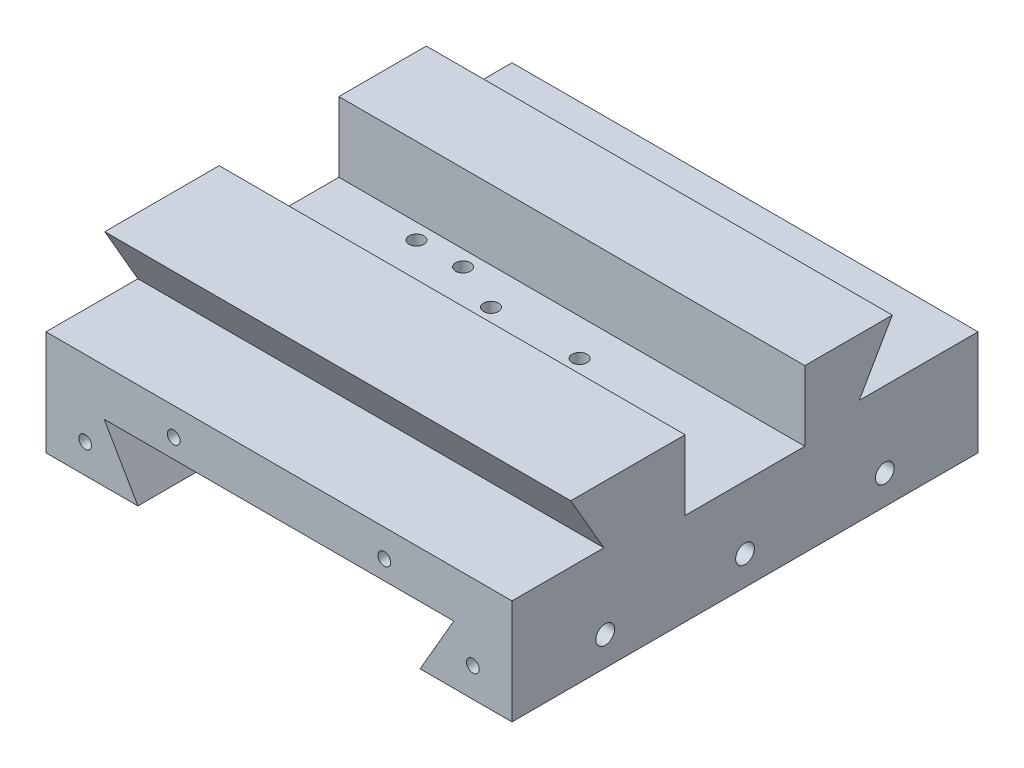
from build123d import *

# Parameters (mm, degrees)
X_CARRIAGE_EXTRUDE_DEPTH                 = 63.5
Y_GUIDE_CUT_EXTRUDE_DEPTH                = 63.5
F_8_32_TAPPED_HOLE1_D                    = 3.4544
F_8_32_TAPPED_HOLE1_DEPTH                = 12.3444
F_8_32_TAPPED_HOLE1_TIP                  = 1.037806461
F_8_32_TAPPED_HOLE2_D                    = 3.4544
F_8_32_TAPPED_HOLE2_DEPTH                = 12.446
F_8_32_TAPPED_HOLE2_TIP                  = 1.037806461
SKETCH8_W                                = 2.5527
SKETCH8_H                                = 63.5
GIB_SCREW_1_4_20_TAPPED_HOLE1_AT_2_COUNT = 2
GIB_SCREW_1_4_20_TAPPED_HOLE1_AT_2_PITCH = 38.1
GIB_SCREW_1_4_20_TAPPED_HOLE1_AT_3_COUNT = 2
GIB_SCREW_1_4_20_TAPPED_HOLE1_AT_3_PITCH = 76.2
F_10_32_TAPPED_HOLE1_D                   = 4.0386
F_10_32_TAPPED_HOLE1_DEPTH               = 9.271


with BuildPart() as part:
    # female-dovetail-profile → x-carriage-extrude (new, symmetric)
    with BuildSketch(Plane.XY):
        Polygon((-47.625, 15.875), (-40.292651581, 15.875), (-16.056336319, 15.875), (16.056336319, 15.875), (47.625, 15.875), (38.459564477, 0), (63.5, 0), (63.5, 31.75), (63.5, 44.45), (-63.5, 44.45), (-63.5, 31.75), (-63.5, 0), (-38.459564477, 0), align=None)
    extrude(amount=X_CARRIAGE_EXTRUDE_DEPTH, both=True)

    # male-dovetail-shoulder-profile → y-guide-cut-extrude (cut, symmetric)
    with BuildSketch(Plane(origin=(0, 0, 0), x_dir=(0, 0, -1), z_dir=(1, 0, 0))):
        Polygon((63.5, 28.575), (38.459564477, 28.575), (31.127216058, 28.575), (40.146004613, 44.196), (16.310336319, 44.196), (16.310336319, 25.146), (-16.310336319, 25.146), (-16.310336319, 44.196), (-47.478353032, 44.196), (-38.459564477, 28.575), (-63.5, 28.575), (-63.5, 44.45), (63.5, 44.45), align=None)
    extrude(amount=Y_GUIDE_CUT_EXTRUDE_DEPTH, both=True, mode=Mode.SUBTRACT)

    # #8-32 Tapped Hole1
    with Locations(Plane(origin=(0, -15.875, 63.5), x_dir=(1, 0, 0), z_dir=(0, 0, 1))):
        with Locations((-52.832, 23.8125), (-28.702, 36.957), (28.702, 36.957), (52.832, 23.8125)):
            Hole(F_8_32_TAPPED_HOLE1_D / 2, depth=F_8_32_TAPPED_HOLE1_DEPTH)
            with Locations((0, 0, -(F_8_32_TAPPED_HOLE1_DEPTH + F_8_32_TAPPED_HOLE1_TIP / 2))):  # 118° drill point
                Cone(0, F_8_32_TAPPED_HOLE1_D / 2, F_8_32_TAPPED_HOLE1_TIP, mode=Mode.SUBTRACT)

    # #8-32 Tapped Hole2
    with Locations(Plane(origin=(0, -15.875, -63.5), x_dir=(-1, 0, 0), z_dir=(0, 0, -1))):
        with Locations((-52.832, 23.8125), (-28.702, 36.957), (28.702, 36.957), (52.832, 23.8125)):
            Hole(F_8_32_TAPPED_HOLE2_D / 2, depth=F_8_32_TAPPED_HOLE2_DEPTH)
            with Locations((0, 0, -(F_8_32_TAPPED_HOLE2_DEPTH + F_8_32_TAPPED_HOLE2_TIP / 2))):  # 118° drill point
                Cone(0, F_8_32_TAPPED_HOLE2_D / 2, F_8_32_TAPPED_HOLE2_TIP, mode=Mode.SUBTRACT)

    # Sketch8 → gib screw 1/4-20 Tapped Hole1 (revolve, cut)
    with BuildSketch(Plane(origin=(0, 7.9375, 38.1), x_dir=(0, 0, 1), z_dir=(0, 1, 0))):
        with Locations((1.27635, 31.75)):
            Rectangle(SKETCH8_W, SKETCH8_H)
    gib_screw_1_4_20_tapped_hole1 = revolve(axis=Axis((-6.35, 7.9375, 38.1), (1, 0, 0)), mode=Mode.SUBTRACT)

    # gib screw 1/4-20 Tapped Hole1 at 2: gib screw 1/4-20 Tapped Hole1 ×2
    with Locations(*[(0, 0, -i * GIB_SCREW_1_4_20_TAPPED_HOLE1_AT_2_PITCH) for i in range(1, GIB_SCREW_1_4_20_TAPPED_HOLE1_AT_2_COUNT)]):
        add(gib_screw_1_4_20_tapped_hole1, mode=Mode.SUBTRACT)

    # gib screw 1/4-20 Tapped Hole1 at 3: gib screw 1/4-20 Tapped Hole1 ×2
    with Locations(*[(0, 0, -i * GIB_SCREW_1_4_20_TAPPED_HOLE1_AT_3_PITCH) for i in range(1, GIB_SCREW_1_4_20_TAPPED_HOLE1_AT_3_COUNT)]):
        add(gib_screw_1_4_20_tapped_hole1, mode=Mode.SUBTRACT)

    # #10-32 Tapped Hole1
    with Locations(Plane(origin=(0, 25.146, 0), x_dir=(1, 0, 0), z_dir=(0, 1, 0))):
        with Locations((-38.1, 12.065), (-38.1, -12.065), (-12.065, 6.35), (-25.4, 12.065), (-25.4, -12.065), (12.065, 6.35), (12.065, -6.35), (-12.065, -6.35)):
            Hole(F_10_32_TAPPED_HOLE1_D / 2, depth=F_10_32_TAPPED_HOLE1_DEPTH)


solid = part.part
